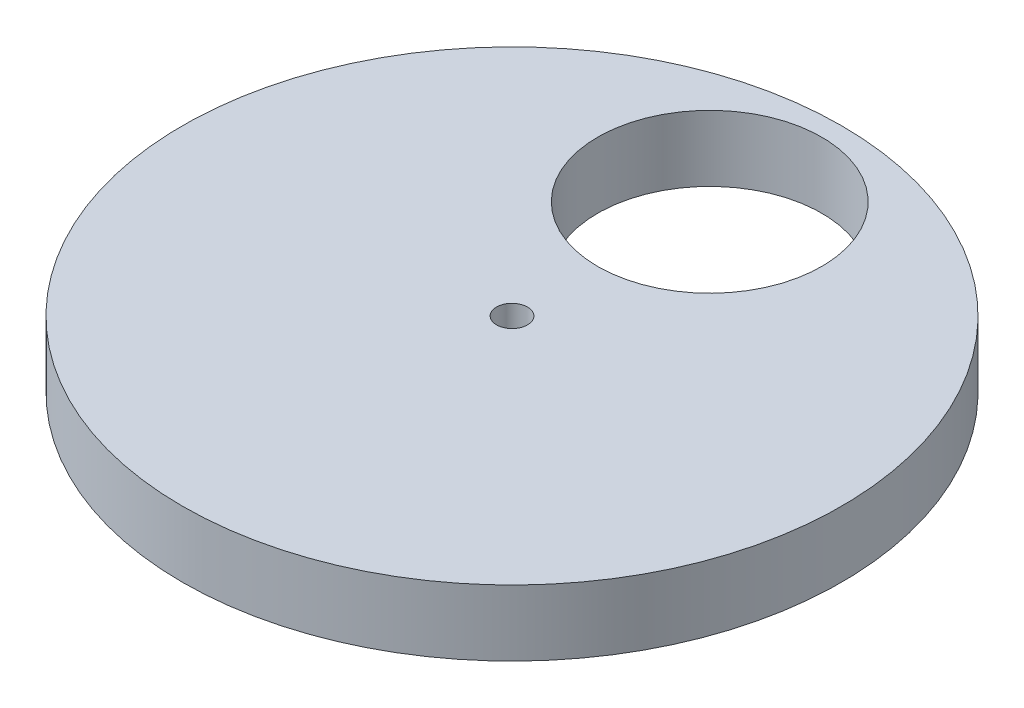
from build123d import *

# Parameters (mm, degrees)
SKETCH2_R           = 50
BOSS_EXTRUDE2_DEPTH = 10
SKETCH3_R           = 17
CUT_EXTRUDE1_DEPTH  = 118
SKETCH5_R           = 2.35
CUT_EXTRUDE2_DEPTH  = 6


with BuildPart() as part:
    # Sketch2 → Boss-Extrude2 (new body)
    with BuildSketch(Plane(origin=(0, 0, 0), x_dir=(1, 0, 0), z_dir=(0, 1, 0))):
        with Locations(Location((0, 0, 0), (0, 0, 270))):
            Circle(SKETCH2_R)
    extrude(amount=BOSS_EXTRUDE2_DEPTH)

    # Sketch3 → Cut-Extrude1 (cut)
    with BuildSketch(Plane(origin=(0, 10, 0), x_dir=(1, 0, 0), z_dir=(0, 1, 0))):
        with Locations(Location((0, 30, 0), (0, 0, 270))):
            Circle(SKETCH3_R)
    extrude(amount=-CUT_EXTRUDE1_DEPTH, mode=Mode.SUBTRACT)

    # Sketch5 → Cut-Extrude2 (cut)
    with BuildSketch(Plane(origin=(0, 10, 0), x_dir=(1, 0, 0), z_dir=(0, 1, 0))):
        with Locations(Location((0, 0, 0), (0, 0, 270))):
            Circle(SKETCH5_R)
    extrude(amount=-CUT_EXTRUDE2_DEPTH, mode=Mode.SUBTRACT)


solid = part.part
